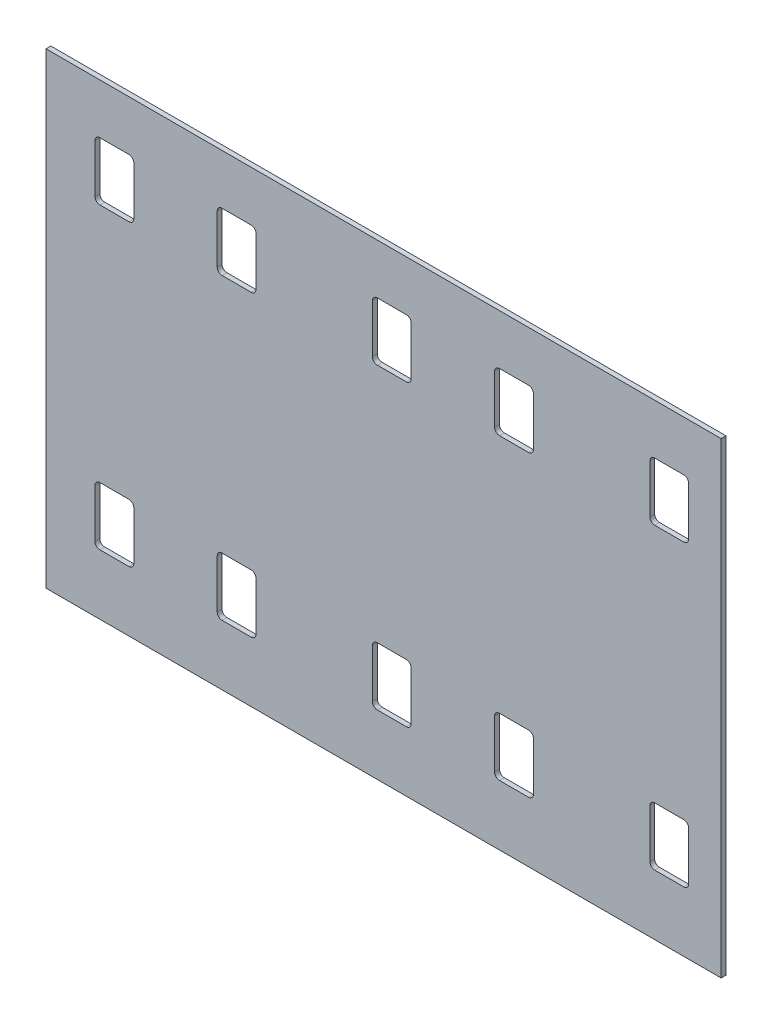
from build123d import *

# Parameters (mm, degrees)
SKETCH1_W           = 441.979400076
SKETCH1_H           = 305.81676
BOSS_EXTRUDE1_DEPTH = 3.175
CUT_EXTRUDE1_DEPTH  = 271.654843319
CUT_EXTRUDE2_DEPTH  = 271.654843319
LPATTERN1_COUNT     = 3
LPATTERN1_PITCH     = 181.613999992
LPATTERN2_COUNT     = 2
LPATTERN2_PITCH     = 181.613999992


with BuildPart() as part:
    # Sketch1 → Boss-Extrude1 (new body)
    with BuildSketch(Plane.XY):
        with Locations((0, -3.32067)):
            Rectangle(SKETCH1_W, SKETCH1_H)
    extrude(amount=BOSS_EXTRUDE1_DEPTH)

    # Sketch2 → Cut-Extrude1 (cut, through all)
    with BuildSketch(Plane.XY.offset(3.175)):
        with BuildLine():
            Line((-166.696625, 116.8), (-185.746625, 116.8))
            ThreePointArc((-185.746625, 116.8), (-187.99168903, 115.87006403), (-188.921625, 113.625))
            Line((-188.921625, 113.625), (-188.921625, 81.875))
            ThreePointArc((-188.921625, 81.875), (-187.99168903, 79.62993597), (-185.746625, 78.7))
            Line((-185.746625, 78.7), (-166.696625, 78.7))
            ThreePointArc((-166.696625, 78.7), (-164.45156097, 79.62993597), (-163.521625, 81.875))
            Line((-163.521625, 81.875), (-163.521625, 113.625))
            ThreePointArc((-163.521625, 113.625), (-164.45156097, 115.87006403), (-166.696625, 116.8))
        make_face()
        with BuildLine():
            Line((-166.696625, -78.7), (-185.746625, -78.7))
            ThreePointArc((-185.746625, -78.7), (-187.99168903, -79.62993597), (-188.921625, -81.875))
            Line((-188.921625, -81.875), (-188.921625, -113.625))
            ThreePointArc((-188.921625, -113.625), (-187.99168903, -115.87006403), (-185.746625, -116.8))
            Line((-185.746625, -116.8), (-166.696625, -116.8))
            ThreePointArc((-166.696625, -116.8), (-164.45156097, -115.87006403), (-163.521625, -113.625))
            Line((-163.521625, -113.625), (-163.521625, -81.875))
            ThreePointArc((-163.521625, -81.875), (-164.45156097, -79.62993597), (-166.696625, -78.7))
        make_face()
    cut_extrude1 = extrude(amount=-CUT_EXTRUDE1_DEPTH, mode=Mode.SUBTRACT)

    # Sketch3 → Cut-Extrude2 (cut, through all)
    with BuildSketch(Plane.XY.offset(3.175)):
        with BuildLine():
            ThreePointArc((-83.506375, 113.625), (-84.43631097, 115.87006403), (-86.681375, 116.8))
            Line((-86.681375, 116.8), (-105.731375, 116.8))
            ThreePointArc((-105.731375, 116.8), (-107.97643903, 115.87006403), (-108.906375, 113.625))
            Line((-108.906375, 113.625), (-108.906375, 81.875))
            ThreePointArc((-108.906375, 81.875), (-107.97643903, 79.62993597), (-105.731375, 78.7))
            Line((-105.731375, 78.7), (-86.681375, 78.7))
            ThreePointArc((-86.681375, 78.7), (-84.43631097, 79.62993597), (-83.506375, 81.875))
            Line((-83.506375, 81.875), (-83.506375, 113.625))
        make_face()
        with BuildLine():
            ThreePointArc((-108.906375, -113.625), (-107.97643903, -115.87006403), (-105.731375, -116.8))
            Line((-105.731375, -116.8), (-86.681375, -116.8))
            ThreePointArc((-86.681375, -116.8), (-84.43631097, -115.87006403), (-83.506375, -113.625))
            Line((-83.506375, -113.625), (-83.506375, -81.875))
            ThreePointArc((-83.506375, -81.875), (-84.43631097, -79.62993597), (-86.681375, -78.7))
            Line((-86.681375, -78.7), (-105.731375, -78.7))
            ThreePointArc((-105.731375, -78.7), (-107.97643903, -79.62993597), (-108.906375, -81.875))
            Line((-108.906375, -81.875), (-108.906375, -113.625))
        make_face()
    cut_extrude2 = extrude(amount=-CUT_EXTRUDE2_DEPTH, mode=Mode.SUBTRACT)

    # LPattern1: Cut-Extrude1 ×3
    with Locations(*[(i * LPATTERN1_PITCH, 0, 0) for i in range(1, LPATTERN1_COUNT)]):
        add(cut_extrude1, mode=Mode.SUBTRACT)

    # LPattern2: Cut-Extrude2 ×2
    with Locations(*[(i * LPATTERN2_PITCH, 0, 0) for i in range(1, LPATTERN2_COUNT)]):
        add(cut_extrude2, mode=Mode.SUBTRACT)


solid = part.part
